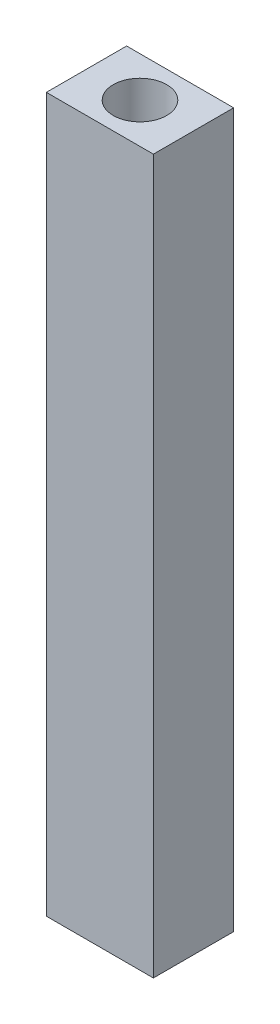
from build123d import *

# Parameters (mm, degrees)
SKETCH_2_W          = 12
SKETCH_2_H          = 9
EXTRUDE_1_DEPTH     = 80
SKETCH_3_R          = 3
CUT_EXTRUDE_1_DEPTH = 20
CUT_EXTRUDE_START   = -20
SKETCH_4_R          = 3
CUT_EXTRUDE_2_DEPTH = 20


with BuildPart() as part:
    # 草图2 → 凸台-拉伸1 (new body)
    with BuildSketch(Plane(origin=(0, 0, 0), x_dir=(1, 0, 0), z_dir=(0, 1, 0))):
        Rectangle(SKETCH_2_W, SKETCH_2_H)
    extrude(amount=EXTRUDE_1_DEPTH)

    # 草图3 → 切除-拉伸1 (cut)
    with BuildSketch(Plane.XZ):
        with Locations(Location((0, 0, 0), (0, 0, 270))):
            Circle(SKETCH_3_R)
    extrude(amount=-CUT_EXTRUDE_1_DEPTH, mode=Mode.SUBTRACT)

    # 草图4 → 切除-拉伸2 (cut)
    with BuildSketch(Plane(origin=(0, 80, 0), x_dir=(1, 0, 0), z_dir=(0, 1, 0)).offset(CUT_EXTRUDE_START)):
        with Locations(Location((0, 0, 0), (0, 0, 90))):
            Circle(SKETCH_4_R)
    extrude(amount=CUT_EXTRUDE_2_DEPTH, mode=Mode.SUBTRACT)


solid = part.part
